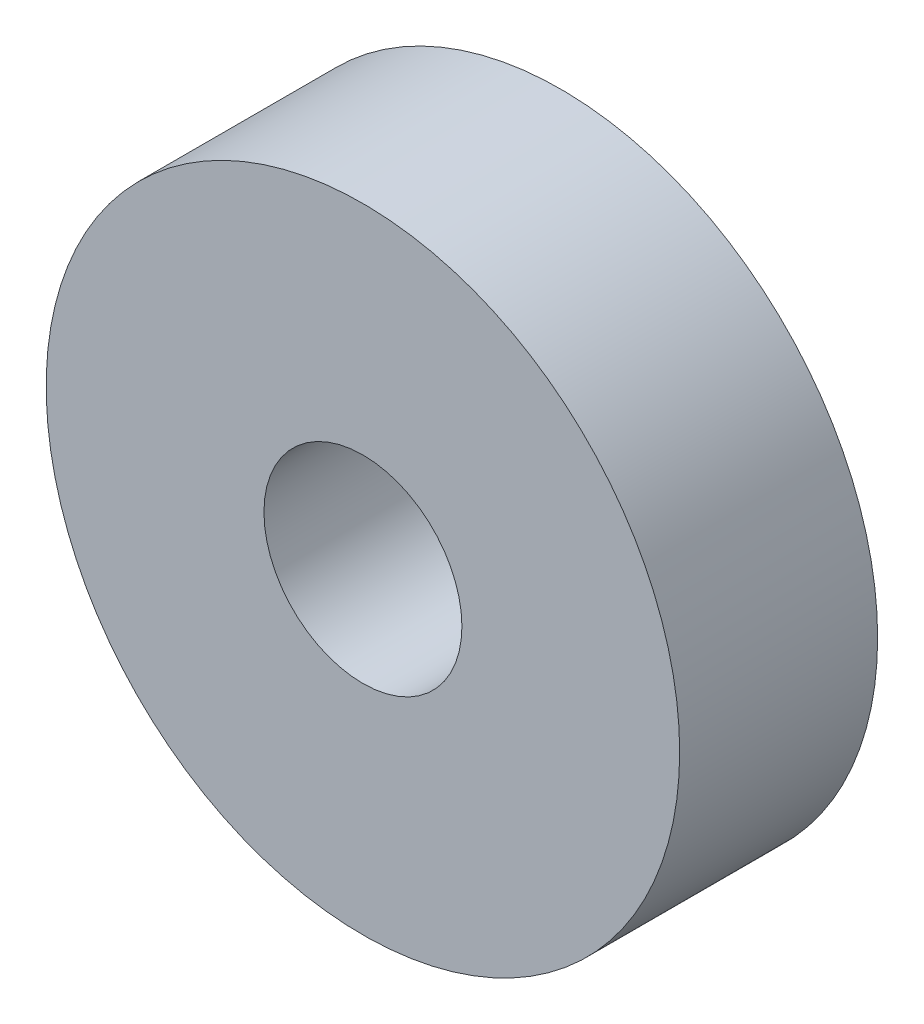
from build123d import *

# Parameters (mm, degrees)
SKETCH1_R           = 8
SKETCH1_R_2         = 2.5
BOSS_EXTRUDE1_DEPTH = 5


with BuildPart() as part:
    # Sketch1 → Boss-Extrude1 (new body)
    with BuildSketch(Plane(origin=(0, 0, 0), x_dir=(0, 1, 0), z_dir=(0, 0, 1))):
        with Locations(Location((0, 0, 0), (0, 0, 270))):
            Circle(SKETCH1_R)
        with Locations(Location((0, 0, 0), (0, 0, 270))):
            Circle(SKETCH1_R_2, mode=Mode.SUBTRACT)
    extrude(amount=BOSS_EXTRUDE1_DEPTH)


solid = part.part
